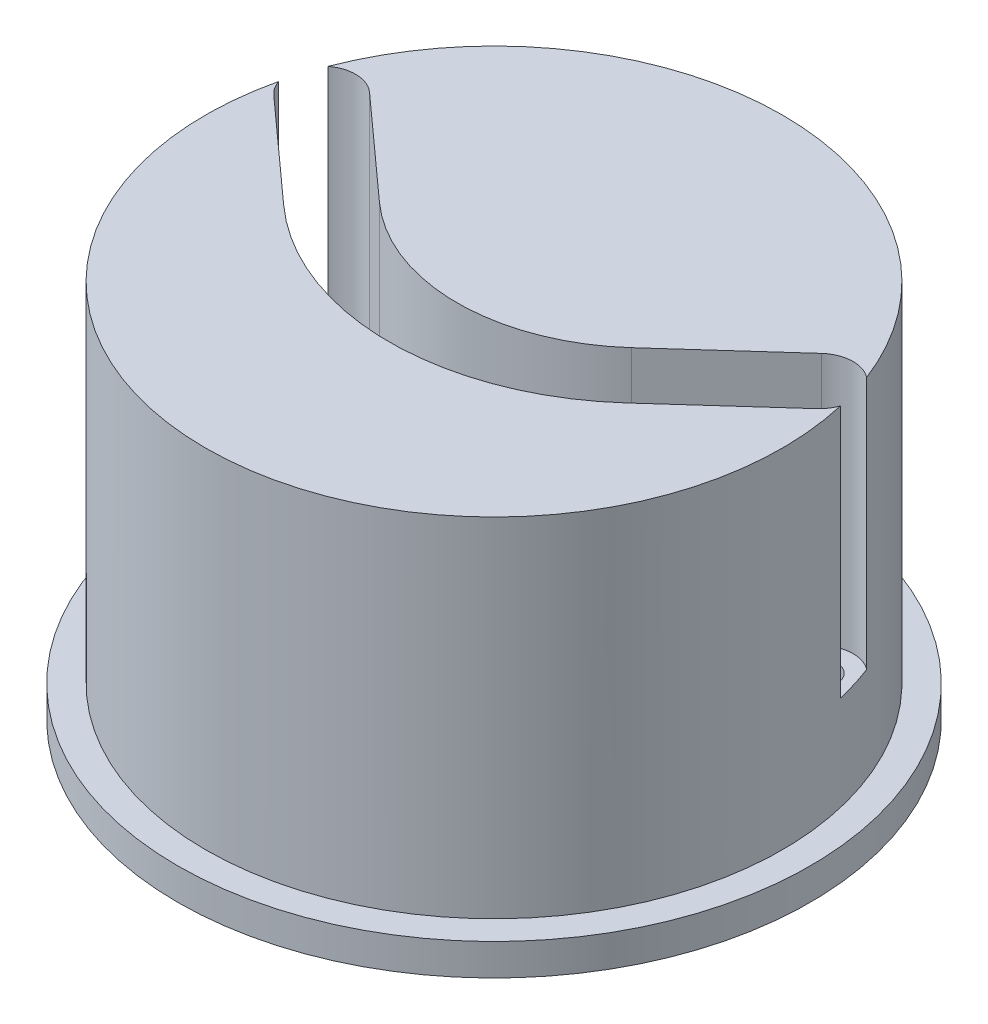
from build123d import *

# Parameters (mm, degrees)
SKETCH2_R           = 14.478
BOSS_EXTRUDE1_DEPTH = 19.05
CUT_EXTRUDE2_DEPTH  = 12.7
SKETCH15_R          = 15.875
BOSS_EXTRUDE2_DEPTH = 1.5875


with BuildPart() as part:
    # Sketch2 → Boss-Extrude1 (new body)
    with BuildSketch(Plane(origin=(0, 0, 0), x_dir=(1, 0, 0), z_dir=(0, 1, 0))):
        with Locations(Location((0, 0, 0), (0, 0, 90))):
            Circle(SKETCH2_R)
        with BuildLine():
            Line((-13.081, 3.175), (-8.059107313, -1.349826056))
            ThreePointArc((-8.059107313, -1.349826056), (0, -4.445), (8.059107313, -1.349826056))
            Line((8.059107313, -1.349826056), (13.081, 3.175))
            ThreePointArc((13.081, 3.175), (13.146371637, 4.430535164), (11.890836473, 4.495906802))
            Line((11.890836473, 4.495906802), (6.868943786, -0.028919255))
            ThreePointArc((6.868943786, -0.028919255), (0, -2.667), (-6.868943786, -0.028919255))
            Line((-6.868943786, -0.028919255), (-11.890836473, 4.495906802))
            ThreePointArc((-11.890836473, 4.495906802), (-13.146371637, 4.430535164), (-13.081, 3.175))
        make_face(mode=Mode.SUBTRACT)
    extrude(amount=BOSS_EXTRUDE1_DEPTH)

    # Sketch14 → Cut-Extrude2 (cut)
    with BuildSketch(Plane(origin=(0, 19.05, 0), x_dir=(1, 0, 0), z_dir=(0, 1, 0))):
        with BuildLine():
            Line((8.603182068, -1.953669166), (13.625074755, 2.571156891))
            ThreePointArc((13.625074755, 2.571156891), (13.750214746, 4.97460992), (11.346761717, 5.099749911))
            Line((11.346761717, 5.099749911), (6.32486903, 0.574923855))
            ThreePointArc((6.32486903, 0.574923855), (0, -1.8542), (-6.32486903, 0.574923855))
            Line((-6.32486903, 0.574923855), (-11.346761717, 5.099749911))
            ThreePointArc((-11.346761717, 5.099749911), (-13.750214746, 4.97460992), (-13.625074755, 2.571156891))
            Line((-13.625074755, 2.571156891), (-8.603182068, -1.953669166))
            ThreePointArc((-8.603182068, -1.953669166), (0, -5.2578), (8.603182068, -1.953669166))
        make_face()
    extrude(amount=-CUT_EXTRUDE2_DEPTH, mode=Mode.SUBTRACT)

    # Sketch15 → Boss-Extrude2 (add)
    with BuildSketch(Plane.XZ):
        with Locations(Location((0, 0, 0), (0, 0, 270))):
            Circle(SKETCH15_R)
        with BuildLine():
            Line((11.890836473, -4.495906802), (6.868943786, 0.028919255))
            ThreePointArc((6.868943786, 0.028919255), (0, 2.667), (-6.868943786, 0.028919255))
            Line((-6.868943786, 0.028919255), (-11.890836473, -4.495906802))
            ThreePointArc((-11.890836473, -4.495906802), (-13.146371637, -4.430535164), (-13.081, -3.175))
            Line((-13.081, -3.175), (-8.059107313, 1.349826056))
            ThreePointArc((-8.059107313, 1.349826056), (0, 4.445), (8.059107313, 1.349826056))
            Line((8.059107313, 1.349826056), (13.081, -3.175))
            ThreePointArc((13.081, -3.175), (13.146371637, -4.430535164), (11.890836473, -4.495906802))
        make_face(mode=Mode.SUBTRACT)
    extrude(amount=-BOSS_EXTRUDE2_DEPTH)


solid = part.part
